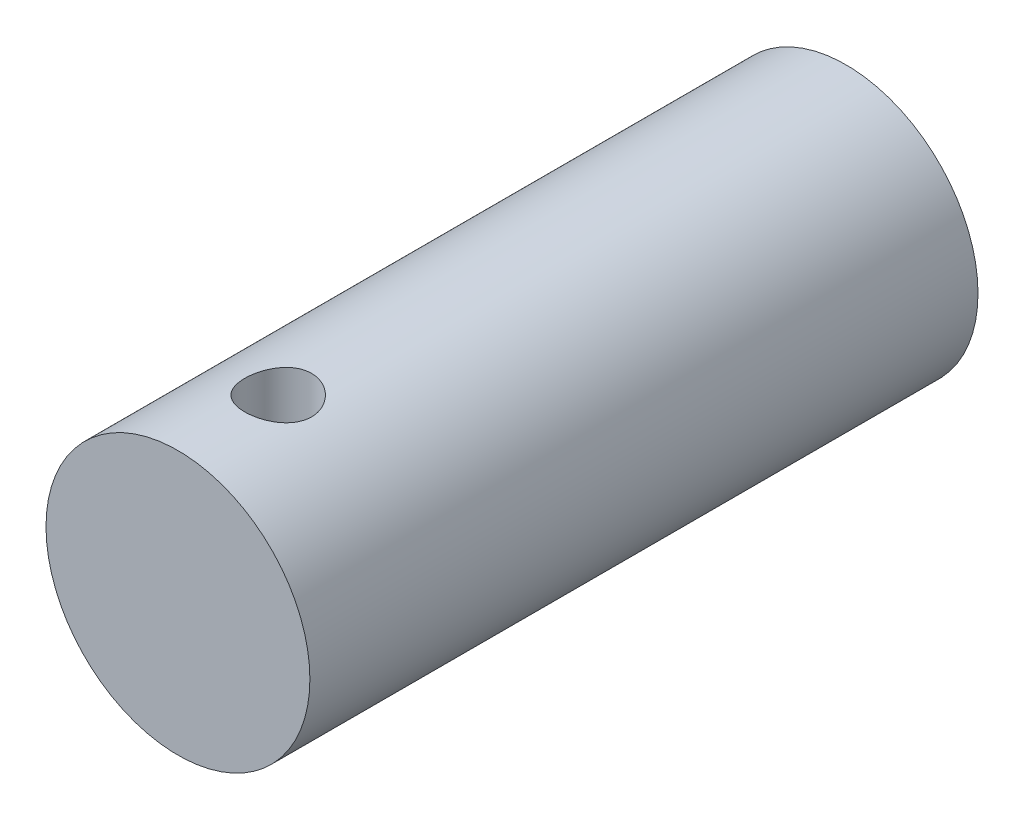
from build123d import *

# Parameters (mm, degrees)
SKETCH1_R           = 3.95
BOSS_EXTRUDE1_DEPTH = 20
SKETCH2_R           = 1
CUT_EXTRUDE1_DEPTH  = 25


with BuildPart() as part:
    # Sketch1 → Boss-Extrude1 (new body)
    with BuildSketch(Plane.XY):
        Circle(SKETCH1_R)
    extrude(amount=BOSS_EXTRUDE1_DEPTH)

    # Sketch2 → Cut-Extrude1 (cut)
    with BuildSketch(Plane(origin=(0, 3.95, 0), x_dir=(1, 0, 0), z_dir=(0, 1, 0))):
        with Locations(Location((0, -17, 0), (0, 0, 270))):
            Circle(SKETCH2_R)
    extrude(amount=-CUT_EXTRUDE1_DEPTH, mode=Mode.SUBTRACT)


solid = part.part
